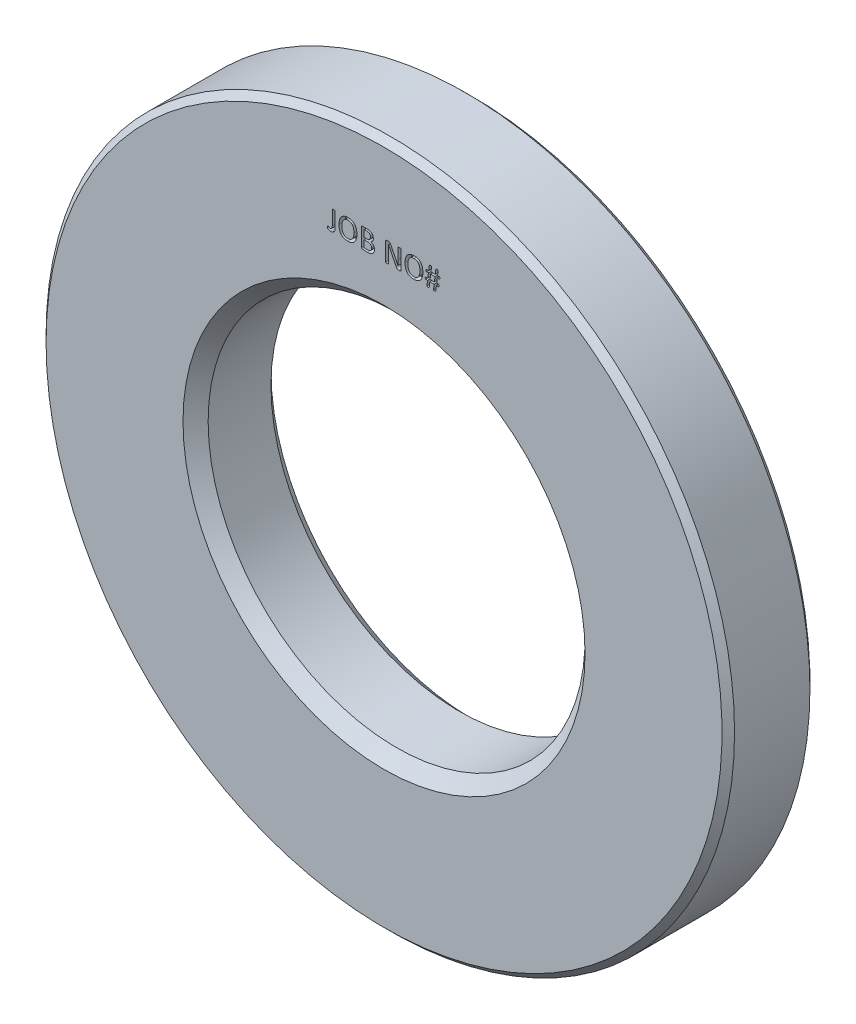
from build123d import *

# Parameters (mm, degrees)
CUT_EXTRUDE1_DEPTH = 0.5


with BuildPart() as part:
    # Sketch1 → Revolve1 (revolve)
    with BuildSketch(Plane(origin=(0, 0, 0), x_dir=(0, 0, -1), z_dir=(1, 0, 0)), mode=Mode.PRIVATE) as revolve1_sk:
        Polygon((-0.5, 27.4), (0, 26.9), (0, 16), (-1, 15), (-6, 15), (-7, 16), (-7, 26.9), (-6.5, 27.4), align=None)
    revolve(revolve1_sk.sketch.rotate(Axis((0, 0, 0), (0, 0, 1)), 90), axis=Axis((0, 0, 0), (0, 0, 1)))

    # Sketch2 → Cut-Extrude1 (cut)
    # profile 1 of 6: a face of its own
    with BuildSketch(Plane.XY.offset(7)):
        with BuildLine():
            add(Edge.make_bspline(
                [(-3.887040441, 19.397239775), (-3.887255388, 19.381915041), (-3.887677265, 19.351837226), (-3.890849974, 19.307592757), (-3.89691333, 19.265404877), (-3.904145733, 19.225150173), (-3.914759237, 19.187538137), (-3.92816029, 19.152392811), (-3.945341556, 19.120390264), (-3.965546352, 19.091149212), (-3.989122665, 19.065088094), (-4.015909811, 19.041808394), (-4.04645397, 19.022132153), (-4.080372695, 19.005651578), (-4.117961729, 18.992226129), (-4.159949529, 18.983591385), (-4.205916705, 18.977452703), (-4.23805239, 18.976927194), (-4.254733456, 18.976654412)],
                knots=[0, 0, 0, 0, 1.143269403, 2.24389188, 3.306089621, 4.321919669, 5.292558619, 6.217355438, 7.122320834, 7.995495485, 8.862570722, 9.737251822, 10.635463651, 11.564477127, 12.545655353, 13.604322577, 14.75644619, 16, 16, 16, 16], degree=3))
            add(Edge.make_bspline(
                [(-4.254733456, 18.976654412), (-4.266551616, 18.976981779), (-4.29033175, 18.977640498), (-4.3252823, 18.983691254), (-4.358525764, 18.992770107), (-4.389190714, 19.003970858), (-4.416462259, 19.017065415), (-4.439433965, 19.030726056), (-4.456404662, 19.043204234), (-4.468640031, 19.052259508), (-4.475171207, 19.060796934), (-4.481210558, 19.067563658), (-4.485117376, 19.075853154), (-4.48910058, 19.085069164), (-4.491317454, 19.096598552), (-4.49331446, 19.110335548), (-4.493696849, 19.126822342), (-4.493910326, 19.138738381), (-4.494025735, 19.145180377)],
                knots=[0, 0, 0, 0, 1.716384094, 3.453654711, 5.138362551, 6.720603015, 8.190716867, 9.530237341, 10.594332446, 11.259531266, 11.723379765, 12.151154719, 12.5700782, 13.045890373, 13.607490544, 14.267268699, 15.06325862, 16, 16, 16, 16], degree=3))
            add(Edge.make_bspline(
                [(-4.494025735, 19.145180377), (-4.494004504, 19.153086693), (-4.493965915, 19.167457266), (-4.492560294, 19.186967811), (-4.49025939, 19.20257561), (-4.486419435, 19.214719639), (-4.480853299, 19.223420422), (-4.474212444, 19.229480482), (-4.466117918, 19.232926367), (-4.460256496, 19.233273754), (-4.457183479, 19.233455882)],
                knots=[0, 0, 0, 0, 1.776573504, 3.229112032, 4.392748535, 5.317491801, 6.067911295, 6.68749501, 7.31188177, 8, 8, 8, 8], degree=3))
            add(Edge.make_bspline(
                [(-4.457183479, 19.233455882), (-4.453315683, 19.232854042), (-4.444042006, 19.231411033), (-4.430951476, 19.221488056), (-4.414321269, 19.21070415), (-4.3949552, 19.197459979), (-4.371556035, 19.185589205), (-4.345367366, 19.17315255), (-4.314047566, 19.164926608), (-4.291507635, 19.163941986), (-4.279538143, 19.163419118)],
                knots=[0, 0, 0, 0, 0.477506399, 1.14490002, 1.978355213, 2.945231979, 4.034114102, 5.21795779, 6.522638321, 8, 8, 8, 8], degree=3))
            add(Edge.make_bspline(
                [(-4.279538143, 19.163419118), (-4.266615837, 19.163852506), (-4.242688315, 19.164654986), (-4.208964041, 19.171947566), (-4.180254971, 19.187420528), (-4.16199641, 19.207935878), (-4.150084831, 19.228053122), (-4.14232581, 19.246286766), (-4.135176682, 19.266937304), (-4.129936125, 19.29057771), (-4.125420117, 19.317463951), (-4.122813262, 19.347955022), (-4.120918027, 19.382138522), (-4.120641972, 19.406112627), (-4.120496324, 19.418761489)],
                knots=[0, 0, 0, 0, 1.336732861, 2.475154611, 3.539688156, 4.652792854, 5.267830809, 5.955205049, 6.69932279, 7.526476031, 8.457383611, 9.519161897, 10.69109697, 12, 12, 12, 12], degree=3))
            Line((-4.120496324, 19.418761489), (-4.120496324, 20.549563419))
            add(Edge.make_bspline(
                [(-4.120496324, 20.549563419), (-4.120180663, 20.552399173), (-4.119544458, 20.558114567), (-4.115231096, 20.566432179), (-4.106869323, 20.573015154), (-4.095032471, 20.578470404), (-4.079132396, 20.582678774), (-4.058562033, 20.585359425), (-4.032979845, 20.587103466), (-4.014107262, 20.587359654), (-4.003768382, 20.5875)],
                knots=[0, 0, 0, 0, 0.512276478, 1.032481238, 1.639408829, 2.395107239, 3.374732133, 4.594325681, 6.134285116, 8, 8, 8, 8], degree=3))
            add(Edge.make_bspline(
                [(-4.003768382, 20.5875), (-3.993670465, 20.587368216), (-3.975158325, 20.58712662), (-3.949726321, 20.585245726), (-3.929088669, 20.582837877), (-3.913165704, 20.578377629), (-3.901309865, 20.573069583), (-3.893180862, 20.566215057), (-3.887842114, 20.558331267), (-3.887302601, 20.552430646), (-3.887040441, 20.549563419)],
                knots=[0, 0, 0, 0, 1.826789397, 3.348985795, 4.615456245, 5.576567201, 6.334318497, 6.942894832, 7.486331902, 8, 8, 8, 8], degree=3))
            Line((-3.887040441, 20.549563419), (-3.887040441, 19.397239775))
        make_face()
    # profile 2 of 6: a face of its own
    with BuildSketch(Plane.XY.offset(7)):
        with BuildLine():
            add(Edge.make_bspline(
                [(-2.159466912, 19.811988741), (-2.160038638, 19.78072143), (-2.161157527, 19.719530196), (-2.169549949, 19.630158582), (-2.183694967, 19.54539067), (-2.203669231, 19.465601677), (-2.22897699, 19.39084265), (-2.260439739, 19.321930054), (-2.297501823, 19.258758095), (-2.339777477, 19.201045676), (-2.388312388, 19.149622957), (-2.442540481, 19.104494852), (-2.502805184, 19.065919727), (-2.568526313, 19.033387938), (-2.640119878, 19.007782555), (-2.717319745, 18.98969189), (-2.800174221, 18.978580218), (-2.857366613, 18.977309164), (-2.886827895, 18.976654412)],
                knots=[0, 0, 0, 0, 1.19137641, 2.331565767, 3.417042525, 4.463281839, 5.462606823, 6.420512668, 7.344711138, 8.249186097, 9.140739235, 10.032400728, 10.93079057, 11.861193805, 12.821170558, 13.821397441, 14.877745384, 16, 16, 16, 16], degree=3))
            add(Edge.make_bspline(
                [(-2.886827895, 18.976654412), (-2.915802693, 18.977195994), (-2.971999069, 18.978246388), (-3.053137919, 18.988845782), (-3.128458107, 19.004769369), (-3.197602609, 19.028257068), (-3.260669892, 19.058313334), (-3.31821246, 19.094269534), (-3.36992855, 19.13642932), (-3.415948594, 19.184742474), (-3.456375531, 19.239064096), (-3.49051175, 19.299853939), (-3.519900878, 19.366241343), (-3.543459755, 19.438878242), (-3.56157208, 19.517380163), (-3.573937475, 19.601691129), (-3.58232168, 19.691444333), (-3.583131591, 19.753239582), (-3.583547794, 19.784995404)],
                knots=[0, 0, 0, 0, 1.137445095, 2.206065128, 3.208407631, 4.156851521, 5.066857725, 5.946688419, 6.815641936, 7.680385637, 8.56104548, 9.467951058, 10.41303433, 11.408286435, 12.462476973, 13.573548823, 14.753076423, 16, 16, 16, 16], degree=3))
            add(Edge.make_bspline(
                [(-3.583547794, 19.784995404), (-3.58298567, 19.81565631), (-3.581888228, 19.87551604), (-3.573373556, 19.963172171), (-3.559353344, 20.046505628), (-3.539202832, 20.125387427), (-3.514153366, 20.199515209), (-3.482431078, 20.267813945), (-3.445669385, 20.330658197), (-3.402714669, 20.387597729), (-3.353999346, 20.438533663), (-3.299586945, 20.483464973), (-3.239343023, 20.521819686), (-3.173586984, 20.55412483), (-3.102063759, 20.579789362), (-3.024592346, 20.597793486), (-2.941501986, 20.608906338), (-2.884188999, 20.610187181), (-2.854727711, 20.610845588)],
                knots=[0, 0, 0, 0, 1.175256309, 2.294469895, 3.372697637, 4.411680733, 5.412616409, 6.367821432, 7.293569431, 8.198811264, 9.095564309, 9.989623777, 10.897346502, 11.827111084, 12.792869429, 13.803655498, 14.870986452, 16, 16, 16, 16], degree=3))
            add(Edge.make_bspline(
                [(-2.854727711, 20.610845588), (-2.826368938, 20.610243056), (-2.771294256, 20.609072897), (-2.691483822, 20.59925706), (-2.617452803, 20.582504459), (-2.548983839, 20.559415992), (-2.485901328, 20.530381634), (-2.42845173, 20.494553861), (-2.376269356, 20.452930579), (-2.330054871, 20.404647206), (-2.289449905, 20.350501775), (-2.25361849, 20.290852827), (-2.22482554, 20.224520751), (-2.200596501, 20.152807174), (-2.182310006, 20.075204081), (-2.168883039, 19.992329367), (-2.160738123, 19.903953568), (-2.159899107, 19.843255541), (-2.159466912, 19.811988741)],
                knots=[0, 0, 0, 0, 1.124252185, 2.183374782, 3.182256192, 4.129105229, 5.043721226, 5.929425601, 6.80741917, 7.683782861, 8.571911764, 9.486451506, 10.436181025, 11.433338738, 12.484662547, 13.593591443, 14.760409517, 16, 16, 16, 16], degree=3))
        make_face()
        with BuildLine():
            add(Edge.make_bspline(
                [(-2.392922794, 19.796303424), (-2.393207355, 19.818195824), (-2.393767577, 19.861295909), (-2.398054588, 19.924760813), (-2.405938081, 19.985822632), (-2.415857172, 20.044358725), (-2.428979179, 20.100073646), (-2.447099447, 20.151942464), (-2.468401937, 20.200386776), (-2.494125145, 20.244750998), (-2.523574241, 20.285349258), (-2.55823126, 20.321045359), (-2.597594227, 20.351791952), (-2.641465382, 20.378032305), (-2.690460199, 20.39899926), (-2.744812534, 20.413797087), (-2.80458885, 20.422583003), (-2.84618499, 20.423567755), (-2.867859605, 20.424080882)],
                knots=[0, 0, 0, 0, 1.169250427, 2.301930944, 3.395008842, 4.456274514, 5.472222399, 6.447763327, 7.38673591, 8.294558986, 9.18170536, 10.058907655, 10.942338117, 11.842252221, 12.781965628, 13.779311434, 14.842859721, 16, 16, 16, 16], degree=3))
            add(Edge.make_bspline(
                [(-2.867859605, 20.424080882), (-2.889541225, 20.423480465), (-2.931182583, 20.422327314), (-2.991107395, 20.412704581), (-3.045679213, 20.396943199), (-3.094875386, 20.374309177), (-3.138689822, 20.346373647), (-3.178337532, 20.314167415), (-3.213766565, 20.277798939), (-3.244426494, 20.23684156), (-3.271276247, 20.192401783), (-3.293848924, 20.144214622), (-3.311971696, 20.092303451), (-3.326573477, 20.03743321), (-3.336724881, 19.979884481), (-3.34440279, 19.920731527), (-3.349368671, 19.860102088), (-3.349849147, 19.8191722), (-3.350091912, 19.798492073)],
                knots=[0, 0, 0, 0, 1.161109193, 2.230006939, 3.242146217, 4.195396554, 5.120768157, 6.019191557, 6.926803525, 7.833666984, 8.754302376, 9.704386277, 10.67901314, 11.696672534, 12.743199842, 13.807421854, 14.892183724, 16, 16, 16, 16], degree=3))
            add(Edge.make_bspline(
                [(-3.350091912, 19.798492073), (-3.349832536, 19.775867625), (-3.349323043, 19.731426361), (-3.34470912, 19.666205198), (-3.33805584, 19.603573649), (-3.327934902, 19.543973034), (-3.314539772, 19.487596752), (-3.297668617, 19.434942425), (-3.276265917, 19.386369257), (-3.251243916, 19.341614343), (-3.221707068, 19.301202498), (-3.187248304, 19.265715973), (-3.148347064, 19.235001124), (-3.104838764, 19.208599892), (-3.055692354, 19.188086911), (-3.000945544, 19.173761452), (-2.940495267, 19.164879567), (-2.898290413, 19.163920158), (-2.876249426, 19.163419118)],
                knots=[0, 0, 0, 0, 1.196993268, 2.351257178, 3.458234918, 4.528672635, 5.547698982, 6.522289971, 7.449941179, 8.351729023, 9.230641879, 10.090605086, 10.960784804, 11.846827774, 12.775304165, 13.767908032, 14.834316289, 16, 16, 16, 16], degree=3))
            add(Edge.make_bspline(
                [(-2.876249426, 19.163419118), (-2.854447693, 19.164028641), (-2.812447239, 19.165202872), (-2.75202722, 19.174750227), (-2.696977878, 19.190556359), (-2.647433271, 19.213203118), (-2.602989323, 19.241194702), (-2.563141595, 19.273758242), (-2.527602795, 19.310638018), (-2.496952804, 19.352093909), (-2.470833827, 19.397728992), (-2.448034404, 19.446394082), (-2.430320883, 19.498873246), (-2.416159561, 19.554133231), (-2.405900502, 19.612108192), (-2.398111261, 19.671981133), (-2.393773209, 19.73361871), (-2.393208257, 19.775261764), (-2.392922794, 19.796303424)],
                knots=[0, 0, 0, 0, 1.156546549, 2.228055893, 3.236790421, 4.186873135, 5.108930184, 6.01699397, 6.911520701, 7.820111692, 8.745392135, 9.698166525, 10.66751403, 11.680142067, 12.723095794, 13.790029056, 14.883332216, 16, 16, 16, 16], degree=3))
        make_face(mode=Mode.SUBTRACT)
    # profile 3 of 6: a face of its own
    with BuildSketch(Plane.XY.offset(7)):
        with BuildLine():
            add(Edge.make_bspline(
                [(-0.758731618, 19.447943474), (-0.758906553, 19.435896362), (-0.759250204, 19.412230354), (-0.763013727, 19.377348356), (-0.769170194, 19.343950144), (-0.780216926, 19.302002102), (-0.799384098, 19.253078736), (-0.830042913, 19.199628632), (-0.868699268, 19.152791219), (-0.913951485, 19.111817046), (-0.966381735, 19.077631146), (-1.024421445, 19.049092659), (-1.087943542, 19.027625684), (-1.143973213, 19.013991116), (-1.19161496, 19.006940213), (-1.230193433, 19.002949968), (-1.271324597, 19.00028971), (-1.29968832, 19.000098429), (-1.314283663, 19)],
                knots=[0, 0, 0, 0, 0.717717175, 1.409923035, 2.087872465, 2.739962737, 3.992762876, 5.207060429, 6.39654258, 7.597119554, 8.831127153, 10.114466416, 11.44133874, 12.819306483, 13.54488211, 14.309911913, 15.13031818, 16, 16, 16, 16], degree=3))
            Line((-1.314283663, 19), (-1.730491728, 19))
            add(Edge.make_bspline(
                [(-1.730491728, 19), (-1.73989047, 19.000968524), (-1.759163638, 19.002954591), (-1.781161907, 19.015312075), (-1.795983893, 19.030090089), (-1.803949684, 19.045594465), (-1.808749531, 19.064522776), (-1.809095553, 19.078270942), (-1.809283088, 19.085722082)],
                knots=[0, 0, 0, 0, 1.283024327, 2.630984544, 3.348831971, 4.123093912, 4.982766836, 6, 6, 6, 6], degree=3))
            Line((-1.809283088, 19.085722082), (-1.809283088, 20.501777918))
            add(Edge.make_bspline(
                [(-1.809283088, 20.501777918), (-1.8091589, 20.509250837), (-1.808929231, 20.523071049), (-1.803375645, 20.541716203), (-1.796084945, 20.557641023), (-1.780603608, 20.572074396), (-1.758568365, 20.584520063), (-1.739169824, 20.5865268), (-1.729762178, 20.5875)],
                knots=[0, 0, 0, 0, 1.01336749, 1.874094362, 2.637715793, 3.364460889, 4.721851402, 6, 6, 6, 6], degree=3))
            Line((-1.729762178, 20.5875), (-1.364987362, 20.5875))
            add(Edge.make_bspline(
                [(-1.364987362, 20.5875), (-1.341997171, 20.587151609), (-1.298265225, 20.5864889), (-1.235846811, 20.581509842), (-1.179981107, 20.572919078), (-1.130021519, 20.560925527), (-1.08541376, 20.545400925), (-1.04487844, 20.527168735), (-1.008173345, 20.505690587), (-0.975481025, 20.480662485), (-0.946620276, 20.452778672), (-0.920829809, 20.422329572), (-0.899994362, 20.38812448), (-0.882148993, 20.351466304), (-0.868860446, 20.311800451), (-0.858988395, 20.26981465), (-0.852999923, 20.225207817), (-0.852414759, 20.194656352), (-0.852113971, 20.178952206)],
                knots=[0, 0, 0, 0, 1.474174086, 2.804174241, 4.011723647, 5.095329047, 6.094001716, 7.036133109, 7.941440574, 8.814754489, 9.669492618, 10.511077664, 11.365673526, 12.230558214, 13.120696017, 14.041748561, 14.993414347, 16, 16, 16, 16], degree=3))
            add(Edge.make_bspline(
                [(-0.852113971, 20.178952206), (-0.852650474, 20.160169766), (-0.853708075, 20.123144209), (-0.864885338, 20.069395513), (-0.881444998, 20.018605217), (-0.904837484, 19.97164647), (-0.93507582, 19.928881497), (-0.972663712, 19.891914677), (-1.015901138, 19.859300015), (-1.048771421, 19.843661442), (-1.065507238, 19.835699104)],
                knots=[0, 0, 0, 0, 1.048663022, 2.067214589, 3.056069741, 4.02890617, 4.989048051, 5.969643828, 6.966249531, 8, 8, 8, 8], degree=3))
            add(Edge.make_bspline(
                [(-1.065507238, 19.835699104), (-1.054995432, 19.833470683), (-1.034092518, 19.829039429), (-1.00375287, 19.818785682), (-0.974054073, 19.807142195), (-0.946021932, 19.791797521), (-0.918990584, 19.774907116), (-0.893751278, 19.755310575), (-0.869937161, 19.73397841), (-0.848495066, 19.71002886), (-0.828514091, 19.684333924), (-0.810741226, 19.656401915), (-0.795362526, 19.626186899), (-0.78223881, 19.594121753), (-0.771610079, 19.560104171), (-0.763908251, 19.524229155), (-0.759564725, 19.486596265), (-0.759012272, 19.460964672), (-0.758731618, 19.447943474)],
                knots=[0, 0, 0, 0, 0.957248695, 1.903506232, 2.851749101, 3.797509654, 4.74791923, 5.691190936, 6.642898169, 7.594605402, 8.553081182, 9.542571088, 10.541401031, 11.572197882, 12.628339055, 13.714924388, 14.839150557, 16, 16, 16, 16], degree=3))
        make_face()
        with BuildLine():
            add(Edge.make_bspline(
                [(-1.085569853, 20.162537339), (-1.086154341, 20.181693287), (-1.087275201, 20.21842825), (-1.097185306, 20.262550993), (-1.108359538, 20.294695776), (-1.119357045, 20.316375998), (-1.132172347, 20.336530725), (-1.147670662, 20.354421575), (-1.165316153, 20.370540718), (-1.185192196, 20.385096972), (-1.207919379, 20.396895609), (-1.233158811, 20.407015239), (-1.26172716, 20.414493814), (-1.294003782, 20.420451649), (-1.330640735, 20.423497362), (-1.356471452, 20.423879401), (-1.37009421, 20.424080882)],
                knots=[0, 0, 0, 0, 1.80161685, 3.454923082, 4.23374735, 5.001974876, 5.73892182, 6.478001242, 7.223705349, 7.986536328, 8.790875398, 9.628756179, 10.54277118, 11.567074548, 12.716909258, 14, 14, 14, 14], degree=3))
            Line((-1.37009421, 20.424080882), (-1.575827206, 20.424080882))
            Line((-1.575827206, 20.424080882), (-1.575827206, 19.887132353))
            Line((-1.575827206, 19.887132353), (-1.349302045, 19.887132353))
            add(Edge.make_bspline(
                [(-1.349302045, 19.887132353), (-1.337010221, 19.887418217), (-1.313571705, 19.887963314), (-1.280188662, 19.891874881), (-1.250480464, 19.898584918), (-1.224359902, 19.908554315), (-1.20167308, 19.921441373), (-1.180538521, 19.935086118), (-1.161912094, 19.951298921), (-1.145404101, 19.969378286), (-1.130654836, 19.989070999), (-1.118436713, 20.010790314), (-1.107577069, 20.03368958), (-1.097271702, 20.066702956), (-1.087588018, 20.109601425), (-1.086244413, 20.144843817), (-1.085569853, 20.162537339)],
                knots=[0, 0, 0, 0, 1.190427861, 2.269952912, 3.249797467, 4.133400118, 4.966172643, 5.77297408, 6.566252748, 7.349767343, 8.141207993, 8.943181338, 9.759977943, 10.590498938, 12.288252332, 14, 14, 14, 14], degree=3))
        make_face(mode=Mode.SUBTRACT)
        with BuildLine():
            add(Edge.make_bspline(
                [(-0.9921875, 19.432622932), (-0.9924679, 19.444188011), (-0.993009827, 19.466539817), (-0.997176941, 19.498994217), (-1.003515093, 19.529380238), (-1.01308211, 19.557607484), (-1.025195425, 19.583584259), (-1.03949827, 19.607731909), (-1.056598892, 19.629497274), (-1.076289359, 19.649096024), (-1.098246744, 19.666667238), (-1.122857639, 19.682197943), (-1.150443522, 19.694791364), (-1.180592602, 19.705404777), (-1.213988182, 19.714013411), (-1.251156081, 19.719441917), (-1.292316483, 19.723294616), (-1.321082293, 19.723569209), (-1.336170152, 19.723713235)],
                knots=[0, 0, 0, 0, 1.076287781, 2.080139435, 3.041481932, 3.961415754, 4.847653846, 5.70568486, 6.568406841, 7.416827124, 8.286574946, 9.181660173, 10.11850025, 11.103020473, 12.154499004, 13.323187523, 14.595994124, 16, 16, 16, 16], degree=3))
            Line((-1.336170152, 19.723713235), (-1.575827206, 19.723713235))
            Line((-1.575827206, 19.723713235), (-1.575827206, 19.163419118))
            Line((-1.575827206, 19.163419118), (-1.285101677, 19.163419118))
            add(Edge.make_bspline(
                [(-1.285101677, 19.163419118), (-1.274025627, 19.163601863), (-1.252551632, 19.163956166), (-1.221501583, 19.16745711), (-1.192462213, 19.172220169), (-1.157305436, 19.182519368), (-1.11686263, 19.200327953), (-1.081289451, 19.225474582), (-1.056305139, 19.249046922), (-1.040224565, 19.269529926), (-1.025970489, 19.291724931), (-1.01386993, 19.316057703), (-1.003943033, 19.342264447), (-0.997026755, 19.370676582), (-0.993075305, 19.401018534), (-0.992488405, 19.421911202), (-0.9921875, 19.432622932)],
                knots=[0, 0, 0, 0, 1.033530584, 2.003785611, 2.914511794, 3.776763325, 5.417999775, 7.014706189, 7.817525687, 8.61704817, 9.438901986, 10.276518073, 11.149388957, 12.04965608, 13.000053123, 14, 14, 14, 14], degree=3))
        make_face(mode=Mode.SUBTRACT)
    # profile 4 of 6: a face of its own
    with BuildSketch(Plane.XY.offset(7)):
        with BuildLine():
            add(Edge.make_bspline(
                [(1.342371324, 19.090464154), (1.342031208, 19.082863224), (1.341390631, 19.068547559), (1.334513005, 19.048922629), (1.324128043, 19.032990123), (1.311031387, 19.020339333), (1.295764898, 19.010632893), (1.278806452, 19.004374123), (1.26119535, 19.000580602), (1.249371996, 19.000192285), (1.243517348, 19)],
                knots=[0, 0, 0, 0, 1.205332051, 2.270133854, 3.263058457, 4.207272684, 5.146716114, 6.120602819, 7.069366549, 8, 8, 8, 8], degree=3))
            Line((1.243517348, 19), (1.169103286, 19))
            add(Edge.make_bspline(
                [(1.169103286, 19), (1.158025373, 19.000360361), (1.137195235, 19.001037958), (1.107444889, 19.005788258), (1.080705469, 19.016196162), (1.055685509, 19.03199429), (1.031796564, 19.054291462), (1.007851869, 19.08288515), (0.984132088, 19.119050289), (0.969913473, 19.146490825), (0.962275965, 19.161230469)],
                knots=[0, 0, 0, 0, 0.949232932, 1.784871716, 2.566305995, 3.389914927, 4.304220435, 5.353751779, 6.578571646, 8, 8, 8, 8], degree=3))
            Line((0.962275965, 19.161230469), (0.502659697, 20.060035616))
            add(Edge.make_bspline(
                [(0.502659697, 20.060035616), (0.490605239, 20.083858623), (0.466054417, 20.132377973), (0.429344101, 20.205722229), (0.39485313, 20.280226514), (0.37273947, 20.329942189), (0.361856618, 20.354408892)],
                knots=[0, 0, 0, 0, 0.981689664, 1.999367364, 3.015423486, 4, 4, 4, 4], degree=3))
            Line((0.361856618, 20.354408892), (0.359303194, 20.354408892))
            add(Edge.make_bspline(
                [(0.359303194, 20.354408892), (0.359992556, 20.324863469), (0.361388174, 20.265048535), (0.361983388, 20.174818725), (0.361825021, 20.083867656), (0.361846099, 20.023193388), (0.361856618, 19.99291705)],
                knots=[0, 0, 0, 0, 0.98097619, 1.98599371, 2.995014897, 4, 4, 4, 4], degree=3))
            Line((0.361856618, 19.99291705), (0.361856618, 19.039030905))
            add(Edge.make_bspline(
                [(0.361856618, 19.039030905), (0.361553631, 19.036184926), (0.360925404, 19.030283933), (0.35618073, 19.021939874), (0.347963644, 19.014716951), (0.335804959, 19.009335071), (0.319579272, 19.006358968), (0.299409364, 19.002190551), (0.273730043, 19.00036397), (0.254855276, 19.000129751), (0.244399127, 19)],
                knots=[0, 0, 0, 0, 0.508335614, 1.054008165, 1.670659208, 2.440203295, 3.401501664, 4.618744696, 6.126869023, 8, 8, 8, 8], degree=3))
            add(Edge.make_bspline(
                [(0.244399127, 19), (0.233944118, 19.000130774), (0.21507141, 19.000366838), (0.189379724, 19.002182338), (0.169359615, 19.006357109), (0.153379419, 19.009196948), (0.141834788, 19.014949651), (0.133623903, 19.02182274), (0.129410524, 19.030387816), (0.128731422, 19.036200455), (0.128400735, 19.039030905)],
                knots=[0, 0, 0, 0, 1.889779863, 3.4113088, 4.639371011, 5.587829463, 6.32466679, 6.946798791, 7.487146164, 8, 8, 8, 8], degree=3))
            Line((0.128400735, 19.039030905), (0.128400735, 20.497035846))
            add(Edge.make_bspline(
                [(0.128400735, 20.497035846), (0.128656947, 20.504627811), (0.129141202, 20.518977029), (0.13519483, 20.5385845), (0.144263118, 20.555260763), (0.158026006, 20.567190554), (0.173309878, 20.576089389), (0.189353267, 20.582840984), (0.206299755, 20.58652648), (0.217754103, 20.58717078), (0.223606962, 20.5875)],
                knots=[0, 0, 0, 0, 1.223169262, 2.311854749, 3.289963268, 4.250317348, 5.211476418, 6.146325302, 7.052822907, 8, 8, 8, 8], degree=3))
            Line((0.223606962, 20.5875), (0.334863281, 20.5875))
            add(Edge.make_bspline(
                [(0.334863281, 20.5875), (0.346924288, 20.587325866), (0.368971527, 20.587007552), (0.399505774, 20.582180423), (0.42579274, 20.574314137), (0.448689822, 20.561205527), (0.470081715, 20.543927947), (0.49014794, 20.521050998), (0.510127522, 20.492706473), (0.52142029, 20.470815636), (0.527464384, 20.459099265)],
                knots=[0, 0, 0, 0, 1.163767092, 2.127339175, 2.97798627, 3.798249142, 4.658572155, 5.623288963, 6.727941249, 8, 8, 8, 8], degree=3))
            Line((0.527464384, 20.459099265), (0.880201631, 19.765662339))
            add(Edge.make_bspline(
                [(0.880201631, 19.765662339), (0.890956434, 19.744776199), (0.912166847, 19.703584961), (0.94268612, 19.641997265), (0.972852171, 19.582052571), (1.001009772, 19.522637263), (1.029415625, 19.464728804), (1.056519565, 19.407039357), (1.084713337, 19.350292862), (1.102549714, 19.312041782), (1.111468865, 19.292914177)],
                knots=[0, 0, 0, 0, 1.0712473, 2.112693089, 3.134304823, 4.131228243, 5.110761677, 6.075495007, 7.037643669, 8, 8, 8, 8], degree=3))
            Line((1.111468865, 19.292914177), (1.112563189, 19.292914177))
            add(Edge.make_bspline(
                [(1.112563189, 19.292914177), (1.111904029, 19.325621445), (1.110558832, 19.392369526), (1.109493618, 19.493173178), (1.109324861, 19.593975175), (1.109050079, 19.660728838), (1.108915441, 19.693436926)],
                knots=[0, 0, 0, 0, 0.980073767, 2.000107263, 3.020088721, 4, 4, 4, 4], degree=3))
            Line((1.108915441, 19.693436926), (1.108915441, 20.548469095))
            add(Edge.make_bspline(
                [(1.108915441, 20.548469095), (1.109226925, 20.551309302), (1.109854713, 20.557033672), (1.114274281, 20.565352311), (1.122538205, 20.572409601), (1.134743831, 20.578082384), (1.150829126, 20.582754144), (1.171590539, 20.585324172), (1.197642815, 20.587150009), (1.217005011, 20.58737448), (1.227832031, 20.5875)],
                knots=[0, 0, 0, 0, 0.502306873, 1.012387733, 1.62172544, 2.391521802, 3.378703101, 4.574561681, 6.084551388, 8, 8, 8, 8], degree=3))
            add(Edge.make_bspline(
                [(1.227832031, 20.5875), (1.237568143, 20.587369057), (1.25572104, 20.587124914), (1.280629925, 20.58517387), (1.30133078, 20.583080654), (1.316927531, 20.577556502), (1.328871616, 20.572121532), (1.336571203, 20.564752153), (1.34145165, 20.556891172), (1.34207289, 20.551202058), (1.342371324, 20.548469095)],
                knots=[0, 0, 0, 0, 1.782961236, 3.324315921, 4.584666104, 5.571046144, 6.348297572, 6.962920232, 7.501802847, 8, 8, 8, 8], degree=3))
            Line((1.342371324, 20.548469095), (1.342371324, 19.090464154))
        make_face()
    # profile 5 of 6: a face of its own
    with BuildSketch(Plane.XY.offset(7)):
        with BuildLine():
            add(Edge.make_bspline(
                [(3.093290441, 19.811988741), (3.092718715, 19.78072143), (3.091599826, 19.719530196), (3.083207404, 19.630158582), (3.069062386, 19.54539067), (3.049088122, 19.465601677), (3.023780362, 19.39084265), (2.992317614, 19.321930054), (2.95525553, 19.258758095), (2.912979876, 19.201045676), (2.864444965, 19.149622957), (2.810216872, 19.104494852), (2.749952169, 19.065919727), (2.68423104, 19.033387938), (2.612637474, 19.007782555), (2.535437608, 18.98969189), (2.452583131, 18.978580218), (2.39539074, 18.977309164), (2.365929458, 18.976654412)],
                knots=[0, 0, 0, 0, 1.19137641, 2.331565767, 3.417042525, 4.463281839, 5.462606823, 6.420512668, 7.344711138, 8.249186097, 9.140739235, 10.032400728, 10.93079057, 11.861193805, 12.821170558, 13.821397441, 14.877745384, 16, 16, 16, 16], degree=3))
            add(Edge.make_bspline(
                [(2.365929458, 18.976654412), (2.33695466, 18.977195994), (2.280758284, 18.978246388), (2.199619434, 18.988845782), (2.124299246, 19.004769369), (2.055154744, 19.028257068), (1.992087461, 19.058313334), (1.934544893, 19.094269534), (1.882828803, 19.13642932), (1.836808759, 19.184742474), (1.796381822, 19.239064096), (1.762245603, 19.299853939), (1.732856475, 19.366241343), (1.709297598, 19.438878242), (1.691185273, 19.517380163), (1.678819878, 19.601691129), (1.670435673, 19.691444333), (1.669625762, 19.753239582), (1.669209559, 19.784995404)],
                knots=[0, 0, 0, 0, 1.137445095, 2.206065128, 3.208407631, 4.156851521, 5.066857725, 5.946688419, 6.815641936, 7.680385637, 8.56104548, 9.467951058, 10.41303433, 11.408286435, 12.462476973, 13.573548823, 14.753076423, 16, 16, 16, 16], degree=3))
            add(Edge.make_bspline(
                [(1.669209559, 19.784995404), (1.669771683, 19.81565631), (1.670869125, 19.87551604), (1.679383797, 19.963172171), (1.693404009, 20.046505628), (1.713554521, 20.125387427), (1.738603987, 20.199515209), (1.770326275, 20.267813945), (1.807087968, 20.330658197), (1.850042684, 20.387597729), (1.898758007, 20.438533663), (1.953170408, 20.483464973), (2.01341433, 20.521819686), (2.079170368, 20.55412483), (2.150693594, 20.579789362), (2.228165007, 20.597793486), (2.311255367, 20.608906338), (2.368568353, 20.610187181), (2.398029642, 20.610845588)],
                knots=[0, 0, 0, 0, 1.175256309, 2.294469895, 3.372697637, 4.411680733, 5.412616409, 6.367821432, 7.293569431, 8.198811264, 9.095564309, 9.989623777, 10.897346502, 11.827111084, 12.792869429, 13.803655498, 14.870986452, 16, 16, 16, 16], degree=3))
            add(Edge.make_bspline(
                [(2.398029642, 20.610845588), (2.426388415, 20.610243056), (2.481463097, 20.609072897), (2.561273531, 20.59925706), (2.63530455, 20.582504459), (2.703773513, 20.559415992), (2.766856025, 20.530381634), (2.824305623, 20.494553861), (2.876487997, 20.452930579), (2.922702482, 20.404647206), (2.963307448, 20.350501775), (2.999138863, 20.290852827), (3.027931813, 20.224520751), (3.052160851, 20.152807174), (3.070447347, 20.075204081), (3.083874314, 19.992329367), (3.092019229, 19.903953568), (3.092858246, 19.843255541), (3.093290441, 19.811988741)],
                knots=[0, 0, 0, 0, 1.124252185, 2.183374782, 3.182256192, 4.129105229, 5.043721226, 5.929425601, 6.80741917, 7.683782861, 8.571911764, 9.486451506, 10.436181025, 11.433338738, 12.484662547, 13.593591443, 14.760409517, 16, 16, 16, 16], degree=3))
        make_face()
        with BuildLine():
            add(Edge.make_bspline(
                [(2.859834559, 19.796303424), (2.859549998, 19.818195824), (2.858989776, 19.861295909), (2.854702765, 19.924760813), (2.846819272, 19.985822632), (2.836900181, 20.044358725), (2.823778174, 20.100073646), (2.805657906, 20.151942464), (2.784355416, 20.200386776), (2.758632208, 20.244750998), (2.729183112, 20.285349258), (2.694526093, 20.321045359), (2.655163126, 20.351791952), (2.611291971, 20.378032305), (2.562297153, 20.39899926), (2.507944819, 20.413797087), (2.448168503, 20.422583003), (2.406572363, 20.423567755), (2.384897748, 20.424080882)],
                knots=[0, 0, 0, 0, 1.169250427, 2.301930944, 3.395008842, 4.456274514, 5.472222399, 6.447763327, 7.38673591, 8.294558986, 9.18170536, 10.058907655, 10.942338117, 11.842252221, 12.781965628, 13.779311434, 14.842859721, 16, 16, 16, 16], degree=3))
            add(Edge.make_bspline(
                [(2.384897748, 20.424080882), (2.363216128, 20.423480465), (2.32157477, 20.422327314), (2.261649958, 20.412704581), (2.20707814, 20.396943199), (2.157881967, 20.374309177), (2.114067531, 20.346373647), (2.074419821, 20.314167415), (2.038990788, 20.277798939), (2.008330859, 20.23684156), (1.981481106, 20.192401783), (1.958908429, 20.144214622), (1.940785657, 20.092303451), (1.926183876, 20.03743321), (1.916032472, 19.979884481), (1.908354563, 19.920731527), (1.903388682, 19.860102088), (1.902908205, 19.8191722), (1.902665441, 19.798492073)],
                knots=[0, 0, 0, 0, 1.161109193, 2.230006939, 3.242146217, 4.195396554, 5.120768157, 6.019191557, 6.926803525, 7.833666984, 8.754302376, 9.704386277, 10.67901314, 11.696672534, 12.743199842, 13.807421854, 14.892183724, 16, 16, 16, 16], degree=3))
            add(Edge.make_bspline(
                [(1.902665441, 19.798492073), (1.902924817, 19.775867625), (1.90343431, 19.731426361), (1.908048233, 19.666205198), (1.914701513, 19.603573649), (1.924822451, 19.543973034), (1.938217581, 19.487596752), (1.955088736, 19.434942425), (1.976491436, 19.386369257), (2.001513437, 19.341614343), (2.031050285, 19.301202498), (2.065509049, 19.265715973), (2.104410289, 19.235001124), (2.147918589, 19.208599892), (2.197064999, 19.188086911), (2.251811809, 19.173761452), (2.312262086, 19.164879567), (2.35446694, 19.163920158), (2.376507927, 19.163419118)],
                knots=[0, 0, 0, 0, 1.196993268, 2.351257178, 3.458234918, 4.528672635, 5.547698982, 6.522289971, 7.449941179, 8.351729023, 9.230641879, 10.090605086, 10.960784804, 11.846827774, 12.775304165, 13.767908032, 14.834316289, 16, 16, 16, 16], degree=3))
            add(Edge.make_bspline(
                [(2.376507927, 19.163419118), (2.39830966, 19.164028641), (2.440310114, 19.165202872), (2.500730133, 19.174750227), (2.555779475, 19.190556359), (2.605324082, 19.213203118), (2.64976803, 19.241194702), (2.689615758, 19.273758242), (2.725154558, 19.310638018), (2.755804549, 19.352093909), (2.781923526, 19.397728992), (2.804722949, 19.446394082), (2.82243647, 19.498873246), (2.836597792, 19.554133231), (2.846856851, 19.612108192), (2.854646092, 19.671981133), (2.858984143, 19.73361871), (2.859549096, 19.775261764), (2.859834559, 19.796303424)],
                knots=[0, 0, 0, 0, 1.156546549, 2.228055893, 3.236790421, 4.186873135, 5.108930184, 6.01699397, 6.911520701, 7.820111692, 8.745392135, 9.698166525, 10.66751403, 11.680142067, 12.723095794, 13.790029056, 14.883332216, 16, 16, 16, 16], degree=3))
        make_face(mode=Mode.SUBTRACT)
    # profile 6 of 6: a face of its own
    with BuildSketch(Plane.XY.offset(7)):
        with BuildLine():
            add(Edge.make_bspline(
                [(4.443686811, 20.084840303), (4.443615813, 20.078139741), (4.443483516, 20.065653909), (4.440819685, 20.048571793), (4.437336359, 20.03426246), (4.432327107, 20.022844604), (4.426024354, 20.01403768), (4.41857832, 20.007982696), (4.410283721, 20.004521779), (4.404563035, 20.004078982), (4.401737707, 20.003860294)],
                knots=[0, 0, 0, 0, 1.589262348, 2.961432369, 4.096102457, 5.078331196, 5.904221961, 6.643823622, 7.330212411, 8, 8, 8, 8], degree=3))
            Line((4.401737707, 20.003860294), (4.240507238, 20.003860294))
            Line((4.240507238, 20.003860294), (4.191262638, 19.606985294))
            Line((4.191262638, 19.606985294), (4.333889591, 19.606985294))
            add(Edge.make_bspline(
                [(4.333889591, 19.606985294), (4.339791638, 19.606012343), (4.352421355, 19.603930337), (4.363597516, 19.590031046), (4.36989354, 19.575783437), (4.373379186, 19.561303462), (4.375517178, 19.543947057), (4.375725706, 19.531364136), (4.375838695, 19.524546186)],
                knots=[0, 0, 0, 0, 1.024381265, 2.192060678, 2.920989636, 3.783789429, 4.799164969, 6, 6, 6, 6], degree=3))
            add(Edge.make_bspline(
                [(4.375838695, 19.524546186), (4.375799066, 19.517842491), (4.375725107, 19.505331629), (4.37267658, 19.488235993), (4.368641181, 19.474077856), (4.364037402, 19.462741256), (4.358575159, 19.453547297), (4.351061045, 19.447714722), (4.342694985, 19.44417202), (4.33684169, 19.443769292), (4.333889591, 19.443566176)],
                knots=[0, 0, 0, 0, 1.589979943, 2.96732174, 4.110197918, 5.08133655, 5.8746187, 6.61455431, 7.301253023, 8, 8, 8, 8], degree=3))
            Line((4.333889591, 19.443566176), (4.170105699, 19.443566176))
            Line((4.170105699, 19.443566176), (4.118672449, 19.033559283))
            add(Edge.make_bspline(
                [(4.118672449, 19.033559283), (4.118182978, 19.030851993), (4.117237385, 19.025621877), (4.113856827, 19.018378189), (4.10823889, 19.011963888), (4.099545663, 19.006831842), (4.08728889, 19.004025916), (4.071605878, 19.001315402), (4.051203505, 19.000089823), (4.035989232, 19.000032221), (4.027478745, 19)],
                knots=[0, 0, 0, 0, 0.616538987, 1.191069088, 1.772062049, 2.507880471, 3.416292323, 4.579883864, 6.086872104, 8, 8, 8, 8], degree=3))
            add(Edge.make_bspline(
                [(4.027478745, 19), (4.018847348, 19.000039696), (4.003148903, 19.000111893), (3.982013245, 19.001302078), (3.965615621, 19.004023202), (3.952942292, 19.006746212), (3.944206278, 19.011996542), (3.938495456, 19.018220262), (3.935688653, 19.025694548), (3.936080826, 19.030866235), (3.936285041, 19.033559283)],
                knots=[0, 0, 0, 0, 1.90406977, 3.463047055, 4.657754838, 5.574976638, 6.296998655, 6.867098148, 7.410065061, 8, 8, 8, 8], degree=3))
            Line((3.936285041, 19.033559283), (3.988083065, 19.443566176))
            Line((3.988083065, 19.443566176), (3.645924288, 19.443566176))
            Line((3.645924288, 19.443566176), (3.594126264, 19.033559283))
            add(Edge.make_bspline(
                [(3.594126264, 19.033559283), (3.593346767, 19.030858401), (3.591857429, 19.025697984), (3.588552432, 19.018609523), (3.583846281, 19.011942344), (3.57565977, 19.006752173), (3.563723311, 19.003997053), (3.54827279, 19.001343063), (3.527996418, 19.000072942), (3.512902592, 19.0000263), (3.504391659, 19)],
                knots=[0, 0, 0, 0, 0.640490516, 1.223747885, 1.778602362, 2.478797056, 3.37433287, 4.555599678, 6.057811177, 8, 8, 8, 8], degree=3))
            add(Edge.make_bspline(
                [(3.504391659, 19), (3.495516819, 19.000036275), (3.479453371, 19.000101933), (3.457836058, 19.001317718), (3.44118564, 19.003985502), (3.428396515, 19.006748431), (3.419660017, 19.011996132), (3.413949288, 19.018220354), (3.411142463, 19.025694523), (3.411534639, 19.030866227), (3.411738856, 19.033559283)],
                knots=[0, 0, 0, 0, 1.931888044, 3.496714451, 4.701813451, 5.606944121, 6.319448198, 6.882032445, 7.417841784, 8, 8, 8, 8], degree=3))
            Line((3.411738856, 19.033559283), (3.462442555, 19.443566176))
            Line((3.462442555, 19.443566176), (3.319450827, 19.443566176))
            add(Edge.make_bspline(
                [(3.319450827, 19.443566176), (3.313708063, 19.444588822), (3.30146269, 19.446769423), (3.290082783, 19.459807771), (3.283812831, 19.473672385), (3.280280973, 19.487896904), (3.278198025, 19.505148231), (3.277983005, 19.517729261), (3.277866498, 19.524546186)],
                knots=[0, 0, 0, 0, 1.019391946, 2.173662861, 2.894153203, 3.749311541, 4.780483416, 6, 6, 6, 6], degree=3))
            add(Edge.make_bspline(
                [(3.277866498, 19.524546186), (3.27809729, 19.531362724), (3.278519567, 19.543834913), (3.280985657, 19.561128692), (3.285082299, 19.575063981), (3.289305619, 19.586740103), (3.29516135, 19.595521511), (3.302006028, 19.602195298), (3.31024742, 19.606571809), (3.31635918, 19.606846394), (3.319450827, 19.606985294)],
                knots=[0, 0, 0, 0, 1.609064992, 2.94409864, 4.106750893, 5.033822991, 5.861431457, 6.571815992, 7.277549842, 8, 8, 8, 8], degree=3))
            Line((3.319450827, 19.606985294), (3.484693819, 19.606985294))
            Line((3.484693819, 19.606985294), (3.535032744, 20.003860294))
            Line((3.535032744, 20.003860294), (3.386204619, 20.003860294))
            add(Edge.make_bspline(
                [(3.386204619, 20.003860294), (3.380297295, 20.00483054), (3.367656288, 20.006906757), (3.356635639, 20.020754905), (3.350175077, 20.03467425), (3.346755566, 20.048694765), (3.344577734, 20.065313091), (3.344368338, 20.077291799), (3.344255515, 20.083745979)],
                knots=[0, 0, 0, 0, 1.050102259, 2.247100714, 2.974367523, 3.837568928, 4.834872758, 6, 6, 6, 6], degree=3))
            add(Edge.make_bspline(
                [(3.344255515, 20.083745979), (3.344380078, 20.0906839), (3.344612456, 20.103626849), (3.346639867, 20.121363739), (3.35020431, 20.136077084), (3.356495162, 20.150325362), (3.367673245, 20.164224404), (3.380302696, 20.166306444), (3.386204619, 20.167279412)],
                knots=[0, 0, 0, 0, 1.209362666, 2.256111029, 3.109812507, 3.831054833, 4.986420944, 6, 6, 6, 6], degree=3))
            Line((3.386204619, 20.167279412), (3.553636259, 20.167279412))
            Line((3.553636259, 20.167279412), (3.603975184, 20.552846392))
            add(Edge.make_bspline(
                [(3.603975184, 20.552846392), (3.604439599, 20.555563775), (3.605345988, 20.560867241), (3.60920138, 20.56816315), (3.615463452, 20.574376304), (3.624995208, 20.579113731), (3.63776684, 20.58304164), (3.654748732, 20.58523871), (3.675792702, 20.587141282), (3.691392537, 20.587373303), (3.69991096, 20.5875)],
                knots=[0, 0, 0, 0, 0.59287892, 1.157110747, 1.751734287, 2.46900856, 3.433125353, 4.629897557, 6.159726601, 8, 8, 8, 8], degree=3))
            add(Edge.make_bspline(
                [(3.69991096, 20.5875), (3.708798182, 20.587400603), (3.724406347, 20.587226038), (3.745060286, 20.585221319), (3.76091551, 20.583158105), (3.772367621, 20.579024524), (3.780868778, 20.574593703), (3.785253906, 20.568023025), (3.786955226, 20.561086821), (3.787285658, 20.556380125), (3.787456916, 20.553940717)],
                knots=[0, 0, 0, 0, 2.038282352, 3.579728909, 4.76816944, 5.686274081, 6.375629938, 6.917567468, 7.438991767, 8, 8, 8, 8], degree=3))
            Line((3.787456916, 20.553940717), (3.735658892, 20.167279412))
            Line((3.735658892, 20.167279412), (4.07781767, 20.167279412))
            Line((4.07781767, 20.167279412), (4.125967946, 20.552846392))
            add(Edge.make_bspline(
                [(4.125967946, 20.552846392), (4.126587814, 20.555551922), (4.127791328, 20.560804874), (4.131523851, 20.568300589), (4.138195889, 20.57425657), (4.147489249, 20.578996014), (4.159966171, 20.583175004), (4.17687059, 20.585219816), (4.19839045, 20.587170336), (4.214478424, 20.587382716), (4.223362822, 20.5875)],
                knots=[0, 0, 0, 0, 0.593301632, 1.151931734, 1.759328007, 2.469481141, 3.374518604, 4.559409186, 6.099973478, 8, 8, 8, 8], degree=3))
            add(Edge.make_bspline(
                [(4.223362822, 20.5875), (4.231885578, 20.58739188), (4.247250869, 20.587196956), (4.267769544, 20.585163327), (4.283680216, 20.583327731), (4.294891696, 20.579012593), (4.302909927, 20.574372608), (4.307513163, 20.568080982), (4.309953186, 20.561163717), (4.309620435, 20.556390285), (4.309449678, 20.553940717)],
                knots=[0, 0, 0, 0, 1.974993889, 3.560627245, 4.789306793, 5.66404493, 6.336784013, 6.900837802, 7.435946211, 8, 8, 8, 8], degree=3))
            Line((4.309449678, 20.553940717), (4.260205078, 20.167279412))
            Line((4.260205078, 20.167279412), (4.401737707, 20.167279412))
            add(Edge.make_bspline(
                [(4.401737707, 20.167279412), (4.40471318, 20.167133775), (4.410714561, 20.166840034), (4.418869992, 20.162274799), (4.426425848, 20.156024164), (4.432584236, 20.146873695), (4.437773448, 20.135330245), (4.441179034, 20.120990714), (4.443379331, 20.103877459), (4.443578653, 20.09153671), (4.443686811, 20.084840303)],
                knots=[0, 0, 0, 0, 0.69069159, 1.39309065, 2.142666949, 2.982541242, 3.953884912, 5.103619885, 6.428349875, 8, 8, 8, 8], degree=3))
        make_face()
        Polygon((3.715961052, 20.003860294), (3.666716452, 19.606985294), (4.007780905, 19.606985294), (4.059578929, 20.003860294), align=None, mode=Mode.SUBTRACT)
    extrude(amount=-CUT_EXTRUDE1_DEPTH, mode=Mode.SUBTRACT)


solid = part.part
